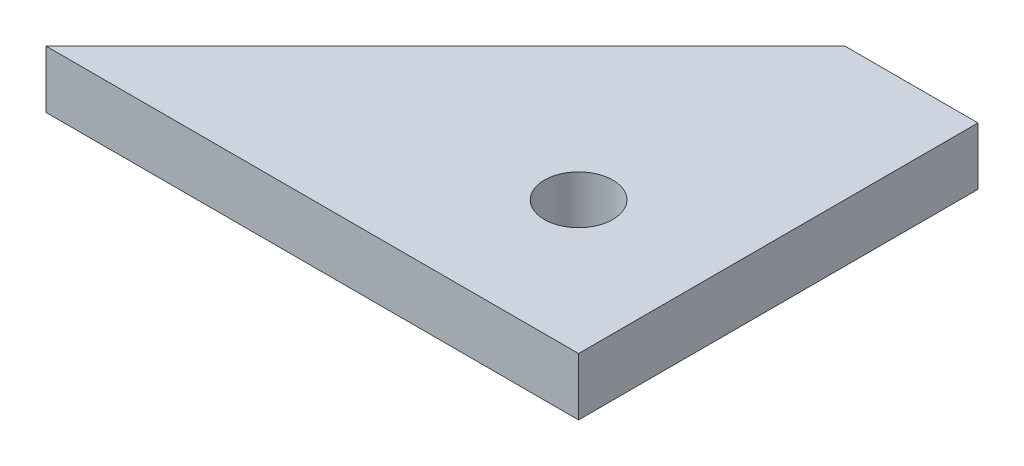
from build123d import *

# Parameters (mm, degrees)
SKETCH2_R           = 1.63195
BOSS_EXTRUDE1_DEPTH = 2.7432


with BuildPart() as part:
    # Sketch2 → Boss-Extrude1 (new body)
    with BuildSketch(Plane(origin=(0, 0, 0), x_dir=(1, 0, 0), z_dir=(0, 1, 0))):
        Polygon((0, 0), (19.05, 19.05), (25.4, 19.05), (25.4, 0), align=None)
        with Locations(Location((19.05, 6.35, 0), (0, 0, 270))):
            Circle(SKETCH2_R, mode=Mode.SUBTRACT)
    extrude(amount=BOSS_EXTRUDE1_DEPTH)


solid = part.part
